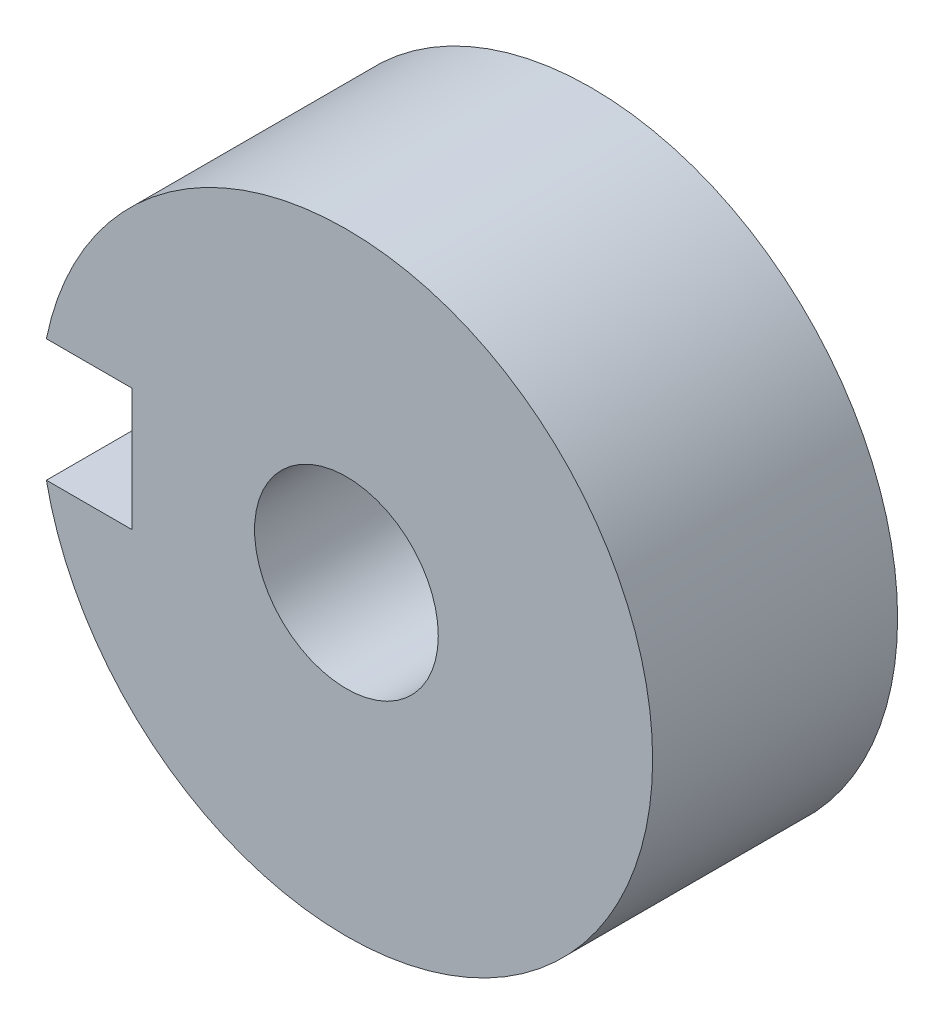
from build123d import *

# Parameters (mm, degrees)
SKETCH1_R           = 5
SKETCH1_R_2         = 1.5
BOSS_EXTRUDE1_DEPTH = 4
SKETCH2_W           = 3
SKETCH2_H           = 2
CUT_EXTRUDE1_DEPTH  = 10


with BuildPart() as part:
    # Sketch1 → Boss-Extrude1 (new body)
    with BuildSketch(Plane.XY):
        Circle(SKETCH1_R)
        Circle(SKETCH1_R_2, mode=Mode.SUBTRACT)
    extrude(amount=BOSS_EXTRUDE1_DEPTH)

    # Sketch2 → Cut-Extrude1 (cut)
    with BuildSketch(Plane.XY.offset(4)):
        with Locations((-5, 0)):
            Rectangle(SKETCH2_W, SKETCH2_H)
    extrude(amount=-CUT_EXTRUDE1_DEPTH, mode=Mode.SUBTRACT)


solid = part.part
